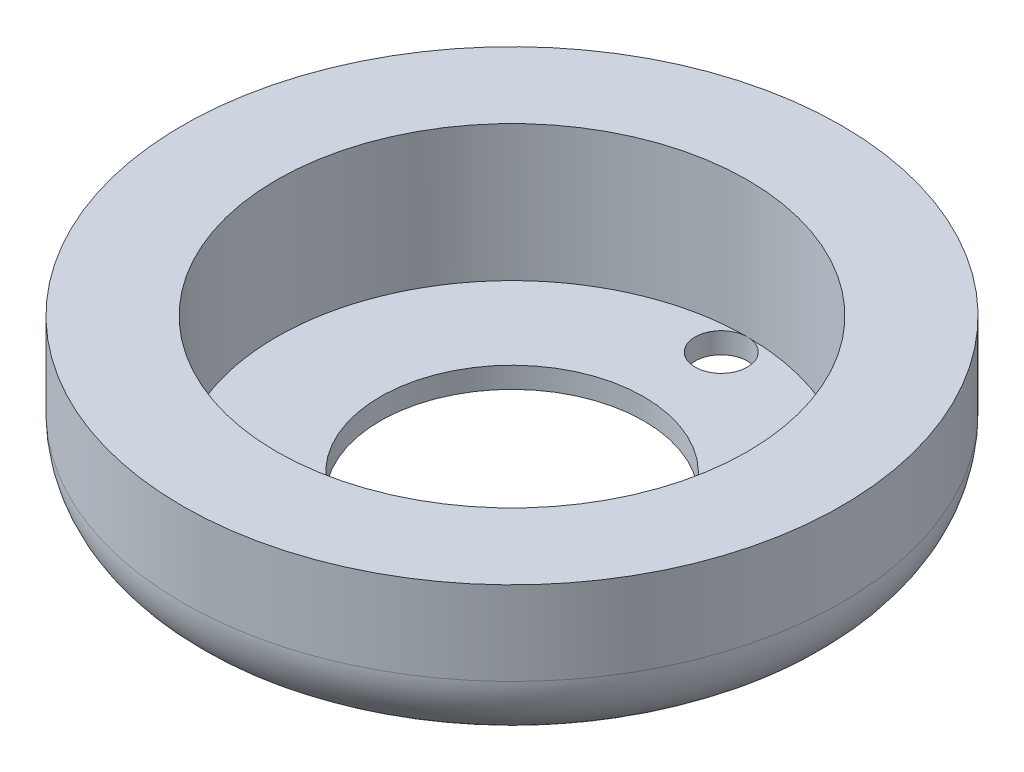
from build123d import *

# Parameters (mm, degrees)
SKETCH1_R           = 31.5
BOSS_EXTRUDE1_DEPTH = 15
SKETCH2_R           = 22.5
CUT_EXTRUDE1_DEPTH  = 13
SKETCH3_R           = 12.6
SKETCH3_R_2         = 2.5
CUT_EXTRUDE2_DEPTH  = 13
FILLET1_R           = 7


with BuildPart() as part:
    # Sketch1 → Boss-Extrude1 (new body)
    with BuildSketch(Plane(origin=(0, 0, 0), x_dir=(1, 0, 0), z_dir=(0, 1, 0))):
        with Locations(Location((0, 0, 0), (0, 0, 270))):
            Circle(SKETCH1_R)
    extrude(amount=BOSS_EXTRUDE1_DEPTH)

    # Sketch2 → Cut-Extrude1 (cut)
    with BuildSketch(Plane(origin=(0, 15, 0), x_dir=(1, 0, 0), z_dir=(0, 1, 0))):
        with Locations(Location((0, 0, 0), (0, 0, 270))):
            Circle(SKETCH2_R)
    extrude(amount=-CUT_EXTRUDE1_DEPTH, mode=Mode.SUBTRACT)

    # Sketch3 → Cut-Extrude2 (cut)
    with BuildSketch(Plane.XZ):
        with Locations(Location((0, 0, 0), (0, 0, 270))):
            Circle(SKETCH3_R)
        with Locations(Location((0, 20, 0), (0, 0, 270))):
            Circle(SKETCH3_R_2)
        with Locations(Location((0, -20, 0), (0, 0, 270))):
            Circle(SKETCH3_R_2)
    extrude(amount=-CUT_EXTRUDE2_DEPTH, mode=Mode.SUBTRACT)

    # Fillet1
    fillet1_edges = [part.edges().sort_by_distance(p)[0] for p in [
        (0, 0, -31.5),
    ]]
    fillet(fillet1_edges, radius=FILLET1_R)


solid = part.part
